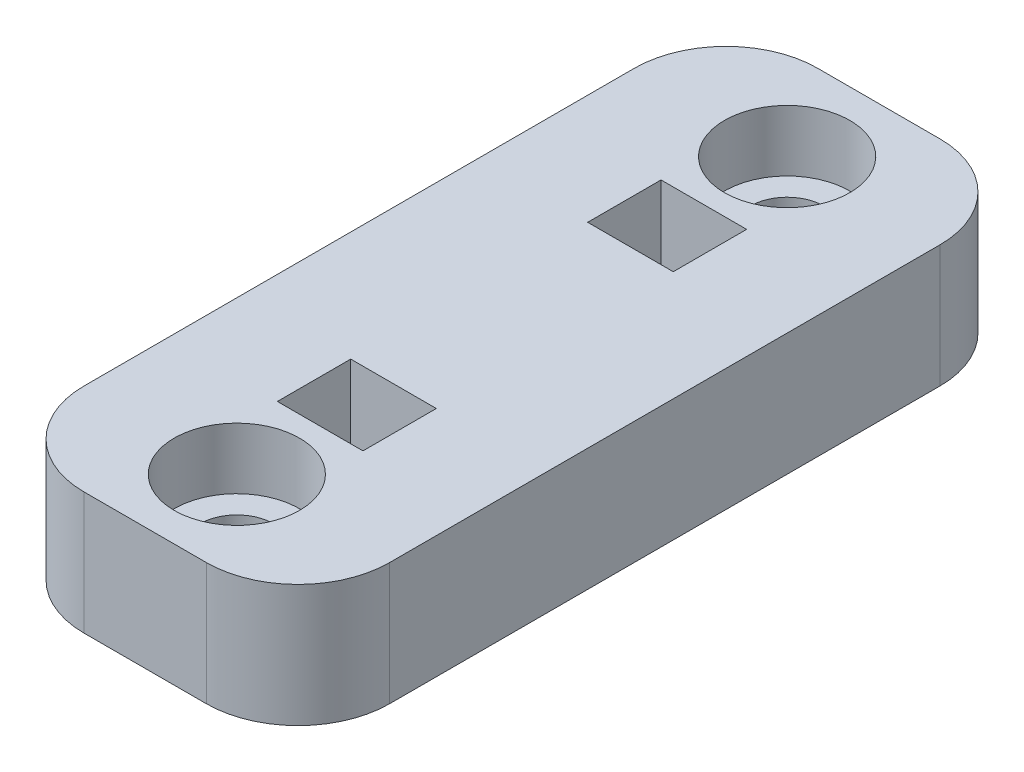
from build123d import *

# Parameters (mm, degrees)
SKETCH1_W           = 10
SKETCH1_H           = 24
SKETCH1_R           = 1.2
SKETCH1_W_2         = 2.8
SKETCH1_H_2         = 2.4
BOSS_EXTRUDE1_DEPTH = 4
FILLET1_R           = 3
SKETCH2_R           = 2.05
CUT_EXTRUDE1_DEPTH  = 2


with BuildPart() as part:
    # Sketch1 → Boss-Extrude1 (new body)
    with BuildSketch(Plane(origin=(0, 0, 0), x_dir=(1, 0, 0), z_dir=(0, 1, 0))):
        with Locations((5, 12)):
            Rectangle(SKETCH1_W, SKETCH1_H)
        with Locations(Location((5, 21, 0), (0, 0, 270))):
            Circle(SKETCH1_R, mode=Mode.SUBTRACT)
        with Locations(Location((5, 3, 0), (0, 0, 270))):
            Circle(SKETCH1_R, mode=Mode.SUBTRACT)
        with Locations((5, 17.075)):
            Rectangle(SKETCH1_W_2, SKETCH1_H_2, mode=Mode.SUBTRACT)
        with Locations((5, 6.925)):
            Rectangle(SKETCH1_W_2, SKETCH1_H_2, mode=Mode.SUBTRACT)
    extrude(amount=BOSS_EXTRUDE1_DEPTH)

    # Fillet1
    fillet1_edges = [part.edges().sort_by_distance(p)[0] for p in [
        (0, 2, -24),
        (10, 2, -24),
        (10, 2, 0),
        (0, 2, 0),
    ]]
    fillet(fillet1_edges, radius=FILLET1_R)

    # Sketch2 → Cut-Extrude1 (cut)
    with BuildSketch(Plane(origin=(0, 4, 0), x_dir=(1, 0, 0), z_dir=(0, 1, 0))):
        with Locations(Location((5, 3, 0), (0, 0, 270))):
            Circle(SKETCH2_R)
        with Locations(Location((5, 21, 0), (0, 0, 270))):
            Circle(SKETCH2_R)
    extrude(amount=-CUT_EXTRUDE1_DEPTH, mode=Mode.SUBTRACT)


solid = part.part
